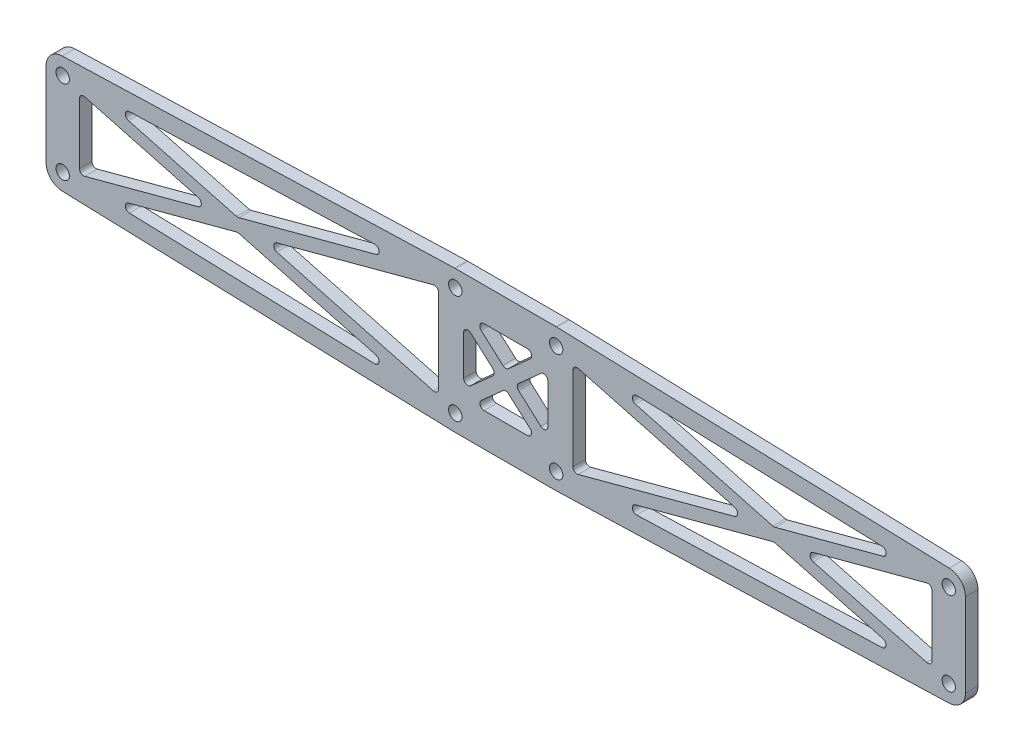
from build123d import *

# Parameters (mm, degrees)
SKETCH_1_W          = 220
SKETCH_1_H          = 34
EXTRUDE_1_DEPTH     = 3
SKETCH_2_R          = 1.6
CUT_EXTRUDE_1_DEPTH = 5
SKETCH_3_R          = 1.6
CUT_EXTRUDE_3_DEPTH = 5
CUT_EXTRUDE_4_DEPTH = 5
FILLET_1_R          = 1


with BuildPart() as part:
    # 草图1 → 凸台-拉伸1 (new body)
    with BuildSketch(Plane.XY):
        Rectangle(SKETCH_1_W, SKETCH_1_H)
    extrude(amount=EXTRUDE_1_DEPTH)

    # 草图2 → 切除-拉伸1 (cut, symmetric)
    with BuildSketch(Plane.XY.offset(3)):
        with Locations(Location((-12.07, 13, 0), (0, 0, 180))):
            Circle(SKETCH_2_R)
        with Locations(Location((12.07, 13, 0), (0, 0, 180))):
            Circle(SKETCH_2_R)
        with Locations(Location((12.07, -13, 0), (0, 0, 180))):
            Circle(SKETCH_2_R)
        with Locations(Location((-12.07, -13, 0), (0, 0, 180))):
            Circle(SKETCH_2_R)
    extrude(amount=CUT_EXTRUDE_1_DEPTH, both=True, mode=Mode.SUBTRACT)

    # 草图3 → 切除-拉伸3 (cut, symmetric)
    with BuildSketch(Plane.XY.offset(3)):
        with BuildLine():
            ThreePointArc((-110, 10), (-108.873217569, 12.782915881), (-106.127689601, 13.997961401))
            Line((-106.127689601, 13.997961401), (-12.197689601, 16.997961401))
            ThreePointArc((-12.197689601, 16.997961401), (-12.133852914, 16.999490318), (-12.069999956, 17))
            Line((-12.069999956, 17), (-110, 17))
            Line((-110, 17), (-110, 10))
        make_face()
        with BuildLine():
            ThreePointArc((-106.127689601, -13.997961401), (-108.873217569, -12.782915881), (-110, -10))
            Line((-110, -10), (-110, -17))
            Line((-110, -17), (-12.070000078, -17))
            ThreePointArc((-12.070000078, -17), (-12.133852976, -16.999490317), (-12.197689601, -16.997961401))
            Line((-12.197689601, -16.997961401), (-106.127689601, -13.997961401))
        make_face()
        with Locations(Location((-106, -10, 0), (0, 0, 180))):
            Circle(SKETCH_3_R)
        with Locations(Location((-106, 10, 0), (0, 0, 180))):
            Circle(SKETCH_3_R)
    cut_extrude_3 = extrude(amount=CUT_EXTRUDE_3_DEPTH, both=True, mode=Mode.SUBTRACT)

    # 镜向1: 切除-拉伸3 across plane
    add(cut_extrude_3.mirror(Plane(origin=(0, 0, 0), x_dir=(0, 0, 1), z_dir=(1, 0, 0))), mode=Mode.SUBTRACT)

    # 草图4 → 切除-拉伸4 (cut, symmetric)
    with BuildSketch(Plane.XY.offset(3)):
        Polygon((-16.07, -11.319443342), (-16.07, 11.319443342), (-58.360424625, 0), align=None)
        Polygon((-64.161827726, 1.552801947), (-22.657455715, 12.661850664), (-96.817055288, 10.293291112), align=None)
        Polygon((-102, -8.574952764), (-69.963230826, 0), (-102, 8.574952764), align=None)
        Polygon((-22.657455715, -12.661850664), (-64.161827726, -1.552801947), (-96.817055288, -10.293291112), align=None)
        Polygon((-10.07, 6.988222073), (-10.07, -6.988222073), (-2.25095597, 0), align=None)
        Polygon((-7.81904403, 9), (0, 2.011777927), (7.81904403, 9), align=None)
        Polygon((10.07, 6.988222073), (2.25095597, 0), (10.07, -6.988222073), align=None)
        Polygon((0, -2.011777927), (-7.81904403, -9), (7.81904403, -9), align=None)
        Polygon((16.07, -11.319443342), (58.360424625, 0), (16.07, 11.319443342), align=None)
        Polygon((64.161827726, 1.552801947), (96.817055288, 10.293291112), (22.657455715, 12.661850664), align=None)
        Polygon((102, 8.574952764), (69.963230826, 0), (102, -8.574952764), align=None)
        Polygon((96.817055288, -10.293291112), (64.161827726, -1.552801947), (22.657455715, -12.661850664), align=None)
    extrude(amount=CUT_EXTRUDE_4_DEPTH, both=True, mode=Mode.SUBTRACT)

    # 圆角1
    fillet_1_edges = [part.edges().sort_by_distance(p)[0] for p in [
        (2.25095597, 0, 1.5),
        (10.07, 6.988222073, 1.5),
        (10.07, -6.988222073, 1.5),
        (0, 2.011777927, 1.5),
        (-7.81904403, 9, 1.5),
        (7.81904403, 9, 1.5),
        (-7.81904403, -9, 1.5),
        (0, -2.011777927, 1.5),
        (7.81904403, -9, 1.5),
        (16.07, 11.319443342, 1.5),
        (58.360424625, 0, 1.5),
        (16.07, -11.319443342, 1.5),
        (-102, -8.574952764, 1.5),
        (-102, 8.574952764, 1.5),
        (-69.963230826, 0, 1.5),
        (-96.817055288, 10.293291112, 1.5),
        (-22.657455715, 12.661850664, 1.5),
        (-64.161827726, 1.552801947, 1.5),
        (-64.161827726, -1.552801947, 1.5),
        (-22.657455715, -12.661850664, 1.5),
        (-96.817055288, -10.293291112, 1.5),
        (-10.07, -6.988222073, 1.5),
        (-10.07, 6.988222073, 1.5),
        (-2.25095597, 0, 1.5),
        (96.817055288, -10.293291112, 1.5),
        (22.657455715, -12.661850664, 1.5),
        (64.161827726, -1.552801947, 1.5),
        (22.657455715, 12.661850664, 1.5),
        (96.817055288, 10.293291112, 1.5),
        (64.161827726, 1.552801947, 1.5),
        (102, 8.574952764, 1.5),
        (102, -8.574952764, 1.5),
        (69.963230826, 0, 1.5),
        (-58.360424625, 0, 1.5),
        (-16.07, 11.319443342, 1.5),
        (-16.07, -11.319443342, 1.5),
    ]]
    fillet(fillet_1_edges, radius=FILLET_1_R)


solid = part.part
